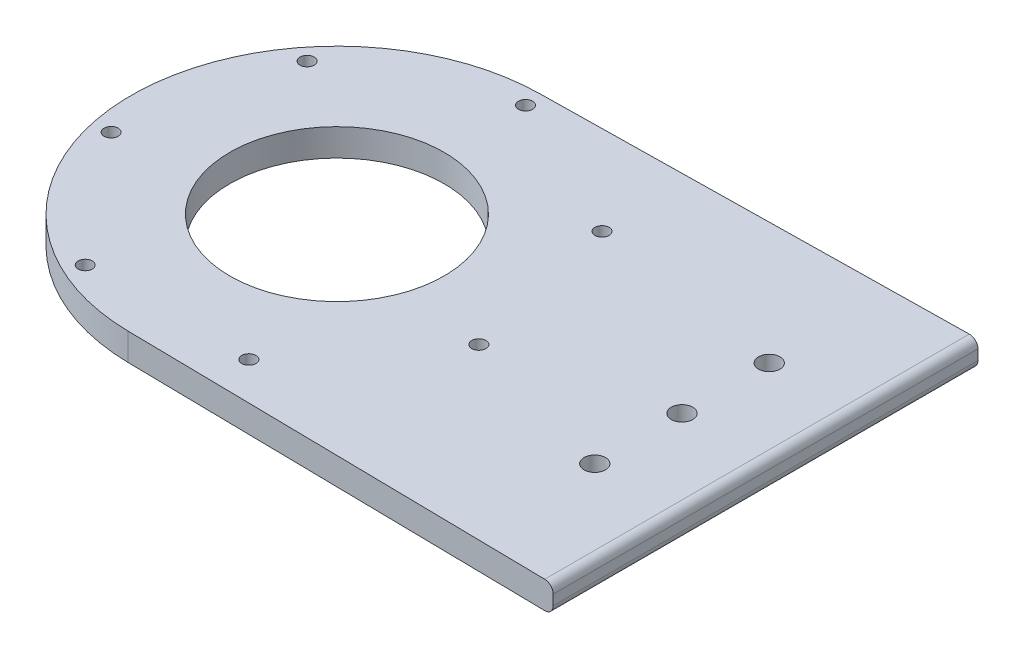
from build123d import *

# Parameters (mm, degrees)
SKETCH1_R                 = 0.5
SKETCH1_R_2               = 25
BOSS_EXTRUDE1_DEPTH       = 6.35
M6X1_0_TAPPED_HOLE1_D     = 5
M6X1_0_TAPPED_HOLE1_DEPTH = 15
M6X1_0_TAPPED_HOLE1_TIP   = 1.502151548
M4X0_7_TAPPED_HOLE1_D     = 3.3
M4X0_7_TAPPED_HOLE1_DEPTH = 10.1
M4X0_7_TAPPED_HOLE1_TIP   = 0.991420021
FILLET1_R                 = 2


with BuildPart() as part:
    # Sketch1 → Boss-Extrude1 (new body)
    with BuildSketch(Plane(origin=(0, 0, 0), x_dir=(1, 0, 0), z_dir=(0, 1, 0))):
        with BuildLine():
            Line((100, -49.556343888), (100, 49.556343888))
            Line((100, 49.556343888), (-0.744186047, 47.994230769))
            ThreePointArc((-0.744186047, 47.994230769), (-48, 0), (-0.744186047, -47.994230769))
            Line((-0.744186047, -47.994230769), (100, -49.556343888))
        make_face()
        with Locations((80.5, -20.35)):
            Circle(SKETCH1_R, mode=Mode.SUBTRACT)
        Circle(SKETCH1_R_2, mode=Mode.SUBTRACT)
        with Locations((80.5, 0)):
            Circle(SKETCH1_R, mode=Mode.SUBTRACT)
        with Locations((80.5, 20.35)):
            Circle(SKETCH1_R, mode=Mode.SUBTRACT)
    extrude(amount=BOSS_EXTRUDE1_DEPTH)

    # M6x1.0 Tapped Hole1
    with Locations(Plane(origin=(80.5, 6.35, -20.35), x_dir=(0, 0, 1), z_dir=(0, 1, 0))):
        with Locations((0, 0), (20.35, 0), (40.7, 0)):
            Hole(M6X1_0_TAPPED_HOLE1_D / 2, depth=M6X1_0_TAPPED_HOLE1_DEPTH)
            with Locations((0, 0, -(M6X1_0_TAPPED_HOLE1_DEPTH + M6X1_0_TAPPED_HOLE1_TIP / 2))):  # 118° drill point
                Cone(0, M6X1_0_TAPPED_HOLE1_D / 2, M6X1_0_TAPPED_HOLE1_TIP, mode=Mode.SUBTRACT)

    # M4x0.7 Tapped Hole1
    with Locations(Plane(origin=(0, 6.35, 0), x_dir=(1, 0, 0), z_dir=(0, 1, 0))):
        with Locations((-34.400585229, 27.433551282), (0, 44), (34.400585229, 27.433551282), (42.896828136, -9.790921094), (19.090884521, -39.642630188), (-19.090884521, -39.642630188), (-42.896828136, -9.790921094)):
            Hole(M4X0_7_TAPPED_HOLE1_D / 2, depth=M4X0_7_TAPPED_HOLE1_DEPTH)
            with Locations((0, 0, -(M4X0_7_TAPPED_HOLE1_DEPTH + M4X0_7_TAPPED_HOLE1_TIP / 2))):  # 118° drill point
                Cone(0, M4X0_7_TAPPED_HOLE1_D / 2, M4X0_7_TAPPED_HOLE1_TIP, mode=Mode.SUBTRACT)

    # Fillet1
    fillet1_edges = [part.edges().sort_by_distance(p)[0] for p in [
        (100, 0, 0),
        (100, 6.35, 0),
    ]]
    fillet(fillet1_edges, radius=FILLET1_R)


solid = part.part
